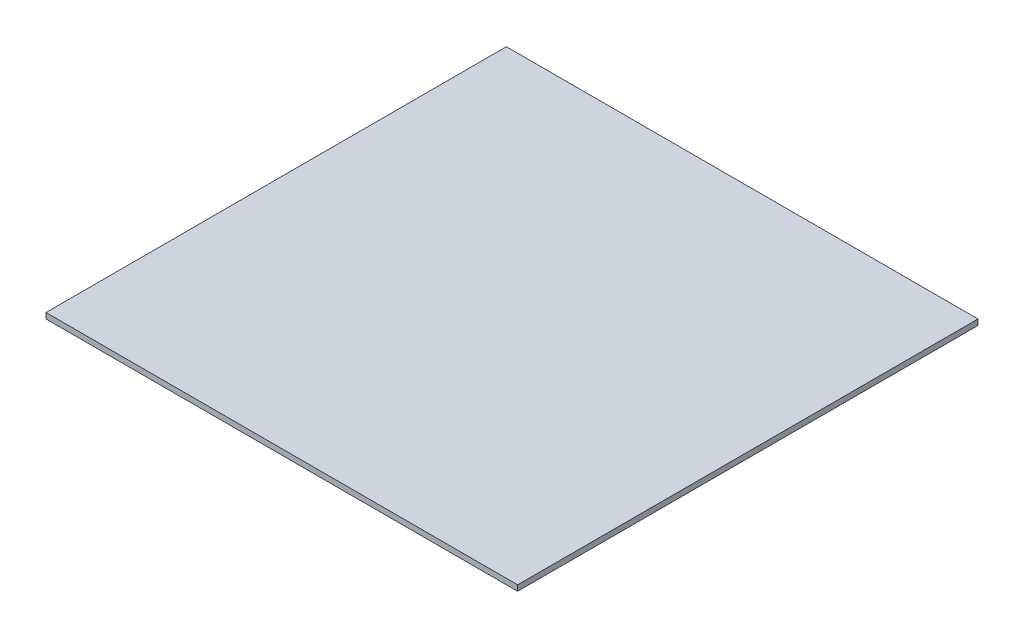
from build123d import *

# Parameters (mm, degrees)
SKETCH1_W           = 1066.8
SKETCH1_H           = 1041.4
BOSS_EXTRUDE1_DEPTH = 12.7


with BuildPart() as part:
    # Sketch1 → Boss-Extrude1 (new body)
    with BuildSketch(Plane(origin=(0, 0, 0), x_dir=(1, 0, 0), z_dir=(0, 1, 0))):
        Rectangle(SKETCH1_W, SKETCH1_H)
    extrude(amount=BOSS_EXTRUDE1_DEPTH)


solid = part.part
